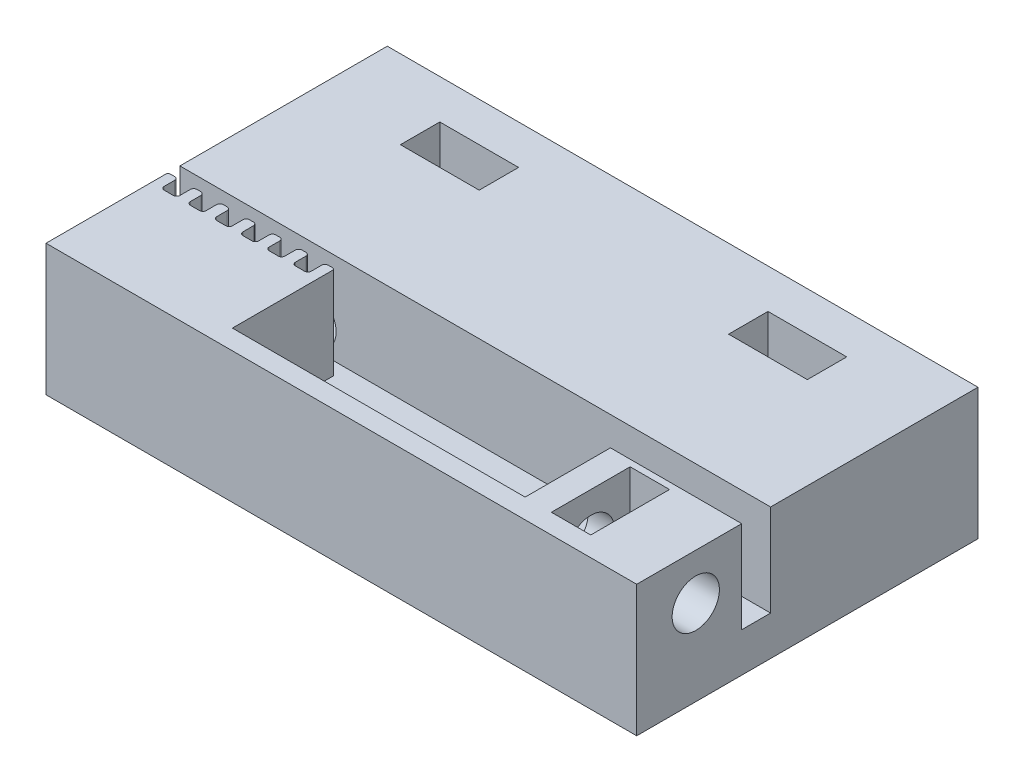
from build123d import *

# Parameters (mm, degrees)
SKETCH_1_W          = 45
SKETCH_1_H          = 26
EXTRUDE_1_DEPTH     = 10
CUT_EXTRUDE_1_DEPTH = 7
SKETCH_4_W          = 30
SKETCH_4_H          = 1.4
CUT_EXTRUDE_3_DEPTH = 7
SKETCH_5_R          = 1.8
CUT_EXTRUDE_4_DEPTH = 30
SKETCH_6_W          = 3
SKETCH_6_H          = 6
CUT_EXTRUDE_5_DEPTH = 6.5
SKETCH_7_W          = 22.3
SKETCH_7_H          = 8.113029467
CUT_EXTRUDE_7_DEPTH = 7
SKETCH_8_R          = 1.9
CUT_EXTRUDE_8_DEPTH = 15.9
SKETCH_10_W         = 6
SKETCH_10_H         = 3
CUT_EXTRUDE_9_DEPTH = 8.5


with BuildPart() as part:
    # 草图1 → 凸台-拉伸1 (new body)
    with BuildSketch(Plane(origin=(0, 0, 0), x_dir=(1, 0, 0), z_dir=(0, 1, 0))):
        with Locations((22.5, 13)):
            Rectangle(SKETCH_1_W, SKETCH_1_H)
    extrude(amount=EXTRUDE_1_DEPTH)

    # 草图3 → 切除-拉伸1 (cut)
    with BuildSketch(Plane(origin=(0, 10, 0), x_dir=(1, 0, 0), z_dir=(0, 1, 0))):
        with BuildLine():
            Line((43, 8), (43.7, 8))
            ThreePointArc((43.7, 8), (43.876776695, 8.073223305), (43.95, 8.25))
            Line((43.95, 8.25), (43.95, 9.05))
            ThreePointArc((43.95, 9.05), (44.023223305, 9.226776695), (44.2, 9.3))
            Line((44.2, 9.3), (44.5, 9.3))
            ThreePointArc((44.5, 9.3), (44.676776695, 9.226776695), (44.75, 9.05))
            Line((44.75, 9.05), (44.75, 8.25))
            ThreePointArc((44.75, 8.25), (44.823223305, 8.073223305), (45, 8))
            Line((45, 8), (45, 10.2))
            Line((45, 10.2), (0, 10.2))
            Line((0, 10.2), (0, 9.2))
            ThreePointArc((0, 9.2), (0.088196601, 9.273606798), (0.2, 9.3))
            Line((0.2, 9.3), (0.5, 9.3))
            ThreePointArc((0.5, 9.3), (0.676776695, 9.226776695), (0.75, 9.05))
            Line((0.75, 9.05), (0.75, 8.25))
            ThreePointArc((0.75, 8.25), (0.823223305, 8.073223305), (1, 8))
            Line((1, 8), (1.7, 8))
            ThreePointArc((1.7, 8), (1.876776695, 8.073223305), (1.95, 8.25))
            Line((1.95, 8.25), (1.95, 9.05))
            ThreePointArc((1.95, 9.05), (2.023223305, 9.226776695), (2.2, 9.3))
            Line((2.2, 9.3), (2.5, 9.3))
            ThreePointArc((2.5, 9.3), (2.676776695, 9.226776695), (2.75, 9.05))
            Line((2.75, 9.05), (2.75, 8.25))
            ThreePointArc((2.75, 8.25), (2.823223305, 8.073223305), (3, 8))
            Line((3, 8), (3.7, 8))
            ThreePointArc((3.7, 8), (3.876776695, 8.073223305), (3.95, 8.25))
            Line((3.95, 8.25), (3.95, 9.05))
            ThreePointArc((3.95, 9.05), (4.023223305, 9.226776695), (4.2, 9.3))
            Line((4.2, 9.3), (4.5, 9.3))
            ThreePointArc((4.5, 9.3), (4.676776695, 9.226776695), (4.75, 9.05))
            Line((4.75, 9.05), (4.75, 8.25))
            ThreePointArc((4.75, 8.25), (4.823223305, 8.073223305), (5, 8))
            Line((5, 8), (5.7, 8))
            ThreePointArc((5.7, 8), (5.876776695, 8.073223305), (5.95, 8.25))
            Line((5.95, 8.25), (5.95, 9.05))
            ThreePointArc((5.95, 9.05), (6.023223305, 9.226776695), (6.2, 9.3))
            Line((6.2, 9.3), (6.5, 9.3))
            ThreePointArc((6.5, 9.3), (6.676776695, 9.226776695), (6.75, 9.05))
            Line((6.75, 9.05), (6.75, 8.25))
            ThreePointArc((6.75, 8.25), (6.823223305, 8.073223305), (7, 8))
            Line((7, 8), (7.7, 8))
            ThreePointArc((7.7, 8), (7.876776695, 8.073223305), (7.95, 8.25))
            Line((7.95, 8.25), (7.95, 9.05))
            ThreePointArc((7.95, 9.05), (8.023223305, 9.226776695), (8.2, 9.3))
            Line((8.2, 9.3), (8.5, 9.3))
            ThreePointArc((8.5, 9.3), (8.676776695, 9.226776695), (8.75, 9.05))
            Line((8.75, 9.05), (8.75, 8.25))
            ThreePointArc((8.75, 8.25), (8.823223305, 8.073223305), (9, 8))
            Line((9, 8), (9.7, 8))
            ThreePointArc((9.7, 8), (9.876776695, 8.073223305), (9.95, 8.25))
            Line((9.95, 8.25), (9.95, 9.05))
            ThreePointArc((9.95, 9.05), (10.023223305, 9.226776695), (10.2, 9.3))
            Line((10.2, 9.3), (10.5, 9.3))
            ThreePointArc((10.5, 9.3), (10.676776695, 9.226776695), (10.75, 9.05))
            Line((10.75, 9.05), (10.75, 8.25))
            ThreePointArc((10.75, 8.25), (10.823223305, 8.073223305), (11, 8))
            Line((11, 8), (11.7, 8))
            ThreePointArc((11.7, 8), (11.876776695, 8.073223305), (11.95, 8.25))
            Line((11.95, 8.25), (11.95, 9.05))
            ThreePointArc((11.95, 9.05), (12.023223305, 9.226776695), (12.2, 9.3))
            Line((12.2, 9.3), (12.5, 9.3))
            ThreePointArc((12.5, 9.3), (12.676776695, 9.226776695), (12.75, 9.05))
            Line((12.75, 9.05), (12.75, 8.25))
            ThreePointArc((12.75, 8.25), (12.823223305, 8.073223305), (13, 8))
            Line((13, 8), (13.7, 8))
            ThreePointArc((13.7, 8), (13.876776695, 8.073223305), (13.95, 8.25))
            Line((13.95, 8.25), (13.95, 9.05))
            ThreePointArc((13.95, 9.05), (14.023223305, 9.226776695), (14.2, 9.3))
            Line((14.2, 9.3), (14.5, 9.3))
            ThreePointArc((14.5, 9.3), (14.676776695, 9.226776695), (14.75, 9.05))
            Line((14.75, 9.05), (14.75, 8.25))
            ThreePointArc((14.75, 8.25), (14.823223305, 8.073223305), (15, 8))
            Line((15, 8), (15.7, 8))
            ThreePointArc((15.7, 8), (15.876776695, 8.073223305), (15.95, 8.25))
            Line((15.95, 8.25), (15.95, 9.05))
            ThreePointArc((15.95, 9.05), (16.023223305, 9.226776695), (16.2, 9.3))
            Line((16.2, 9.3), (16.5, 9.3))
            ThreePointArc((16.5, 9.3), (16.676776695, 9.226776695), (16.75, 9.05))
            Line((16.75, 9.05), (16.75, 8.25))
            ThreePointArc((16.75, 8.25), (16.823223305, 8.073223305), (17, 8))
            Line((17, 8), (17.7, 8))
            ThreePointArc((17.7, 8), (17.876776695, 8.073223305), (17.95, 8.25))
            Line((17.95, 8.25), (17.95, 9.05))
            ThreePointArc((17.95, 9.05), (18.023223305, 9.226776695), (18.2, 9.3))
            Line((18.2, 9.3), (18.5, 9.3))
            ThreePointArc((18.5, 9.3), (18.676776695, 9.226776695), (18.75, 9.05))
            Line((18.75, 9.05), (18.75, 8.25))
            ThreePointArc((18.75, 8.25), (18.823223305, 8.073223305), (19, 8))
            Line((19, 8), (19.7, 8))
            ThreePointArc((19.7, 8), (19.876776695, 8.073223305), (19.95, 8.25))
            Line((19.95, 8.25), (19.95, 9.05))
            ThreePointArc((19.95, 9.05), (20.023223305, 9.226776695), (20.2, 9.3))
            Line((20.2, 9.3), (20.5, 9.3))
            ThreePointArc((20.5, 9.3), (20.676776695, 9.226776695), (20.75, 9.05))
            Line((20.75, 9.05), (20.75, 8.25))
            ThreePointArc((20.75, 8.25), (20.823223305, 8.073223305), (21, 8))
            Line((21, 8), (21.7, 8))
            ThreePointArc((21.7, 8), (21.876776695, 8.073223305), (21.95, 8.25))
            Line((21.95, 8.25), (21.95, 9.05))
            ThreePointArc((21.95, 9.05), (22.023223305, 9.226776695), (22.2, 9.3))
            Line((22.2, 9.3), (22.5, 9.3))
            ThreePointArc((22.5, 9.3), (22.676776695, 9.226776695), (22.75, 9.05))
            Line((22.75, 9.05), (22.75, 8.25))
            ThreePointArc((22.75, 8.25), (22.823223305, 8.073223305), (23, 8))
            Line((23, 8), (23.7, 8))
            ThreePointArc((23.7, 8), (23.876776695, 8.073223305), (23.95, 8.25))
            Line((23.95, 8.25), (23.95, 9.05))
            ThreePointArc((23.95, 9.05), (24.023223305, 9.226776695), (24.2, 9.3))
            Line((24.2, 9.3), (24.5, 9.3))
            ThreePointArc((24.5, 9.3), (24.676776695, 9.226776695), (24.75, 9.05))
            Line((24.75, 9.05), (24.75, 8.25))
            ThreePointArc((24.75, 8.25), (24.823223305, 8.073223305), (25, 8))
            Line((25, 8), (25.7, 8))
            ThreePointArc((25.7, 8), (25.876776695, 8.073223305), (25.95, 8.25))
            Line((25.95, 8.25), (25.95, 9.05))
            ThreePointArc((25.95, 9.05), (26.023223305, 9.226776695), (26.2, 9.3))
            Line((26.2, 9.3), (26.5, 9.3))
            ThreePointArc((26.5, 9.3), (26.676776695, 9.226776695), (26.75, 9.05))
            Line((26.75, 9.05), (26.75, 8.25))
            ThreePointArc((26.75, 8.25), (26.823223305, 8.073223305), (27, 8))
            Line((27, 8), (27.7, 8))
            ThreePointArc((27.7, 8), (27.876776695, 8.073223305), (27.95, 8.25))
            Line((27.95, 8.25), (27.95, 9.05))
            ThreePointArc((27.95, 9.05), (28.023223305, 9.226776695), (28.2, 9.3))
            Line((28.2, 9.3), (28.5, 9.3))
            ThreePointArc((28.5, 9.3), (28.676776695, 9.226776695), (28.75, 9.05))
            Line((28.75, 9.05), (28.75, 8.25))
            ThreePointArc((28.75, 8.25), (28.823223305, 8.073223305), (29, 8))
            Line((29, 8), (29.7, 8))
            ThreePointArc((29.7, 8), (29.876776695, 8.073223305), (29.95, 8.25))
            Line((29.95, 8.25), (29.95, 9.05))
            ThreePointArc((29.95, 9.05), (30.023223305, 9.226776695), (30.2, 9.3))
            Line((30.2, 9.3), (30.5, 9.3))
            ThreePointArc((30.5, 9.3), (30.676776695, 9.226776695), (30.75, 9.05))
            Line((30.75, 9.05), (30.75, 8.25))
            ThreePointArc((30.75, 8.25), (30.823223305, 8.073223305), (31, 8))
            Line((31, 8), (31.7, 8))
            ThreePointArc((31.7, 8), (31.876776695, 8.073223305), (31.95, 8.25))
            Line((31.95, 8.25), (31.95, 9.05))
            ThreePointArc((31.95, 9.05), (32.023223305, 9.226776695), (32.2, 9.3))
            Line((32.2, 9.3), (32.5, 9.3))
            ThreePointArc((32.5, 9.3), (32.676776695, 9.226776695), (32.75, 9.05))
            Line((32.75, 9.05), (32.75, 8.25))
            ThreePointArc((32.75, 8.25), (32.823223305, 8.073223305), (33, 8))
            Line((33, 8), (33.7, 8))
            ThreePointArc((33.7, 8), (33.876776695, 8.073223305), (33.95, 8.25))
            Line((33.95, 8.25), (33.95, 9.05))
            ThreePointArc((33.95, 9.05), (34.023223305, 9.226776695), (34.2, 9.3))
            Line((34.2, 9.3), (34.5, 9.3))
            ThreePointArc((34.5, 9.3), (34.676776695, 9.226776695), (34.75, 9.05))
            Line((34.75, 9.05), (34.75, 8.25))
            ThreePointArc((34.75, 8.25), (34.823223305, 8.073223305), (35, 8))
            Line((35, 8), (35.7, 8))
            ThreePointArc((35.7, 8), (35.876776695, 8.073223305), (35.95, 8.25))
            Line((35.95, 8.25), (35.95, 9.05))
            ThreePointArc((35.95, 9.05), (36.023223305, 9.226776695), (36.2, 9.3))
            Line((36.2, 9.3), (36.5, 9.3))
            ThreePointArc((36.5, 9.3), (36.676776695, 9.226776695), (36.75, 9.05))
            Line((36.75, 9.05), (36.75, 8.25))
            ThreePointArc((36.75, 8.25), (36.823223305, 8.073223305), (37, 8))
            Line((37, 8), (37.7, 8))
            ThreePointArc((37.7, 8), (37.876776695, 8.073223305), (37.95, 8.25))
            Line((37.95, 8.25), (37.95, 9.05))
            ThreePointArc((37.95, 9.05), (38.023223305, 9.226776695), (38.2, 9.3))
            Line((38.2, 9.3), (38.5, 9.3))
            ThreePointArc((38.5, 9.3), (38.676776695, 9.226776695), (38.75, 9.05))
            Line((38.75, 9.05), (38.75, 8.25))
            ThreePointArc((38.75, 8.25), (38.823223305, 8.073223305), (39, 8))
            Line((39, 8), (39.7, 8))
            ThreePointArc((39.7, 8), (39.876776695, 8.073223305), (39.95, 8.25))
            Line((39.95, 8.25), (39.95, 9.05))
            ThreePointArc((39.95, 9.05), (40.023223305, 9.226776695), (40.2, 9.3))
            Line((40.2, 9.3), (40.5, 9.3))
            ThreePointArc((40.5, 9.3), (40.676776695, 9.226776695), (40.75, 9.05))
            Line((40.75, 9.05), (40.75, 8.25))
            ThreePointArc((40.75, 8.25), (40.823223305, 8.073223305), (41, 8))
            Line((41, 8), (41.7, 8))
            ThreePointArc((41.7, 8), (41.876776695, 8.073223305), (41.95, 8.25))
            Line((41.95, 8.25), (41.95, 9.05))
            ThreePointArc((41.95, 9.05), (42.023223305, 9.226776695), (42.2, 9.3))
            Line((42.2, 9.3), (42.5, 9.3))
            ThreePointArc((42.5, 9.3), (42.676776695, 9.226776695), (42.75, 9.05))
            Line((42.75, 9.05), (42.75, 8.25))
            ThreePointArc((42.75, 8.25), (42.823223305, 8.073223305), (43, 8))
        make_face()
    extrude(amount=-CUT_EXTRUDE_1_DEPTH, mode=Mode.SUBTRACT)

    # 草图4 → 切除-拉伸3 (cut)
    with BuildSketch(Plane(origin=(0, 10, 0), x_dir=(1, 0, 0), z_dir=(0, 1, 0))):
        with Locations((30, 8.7)):
            Rectangle(SKETCH_4_W, SKETCH_4_H)
    extrude(amount=-CUT_EXTRUDE_3_DEPTH, mode=Mode.SUBTRACT)

    # 草图5 → 切除-拉伸4 (cut)
    with BuildSketch(Plane(origin=(45, 0, 0), x_dir=(0, 0, -1), z_dir=(1, 0, 0))):
        with Locations((4.5, 6.5)):
            Circle(SKETCH_5_R)
    extrude(amount=-CUT_EXTRUDE_4_DEPTH, mode=Mode.SUBTRACT)

    # 草图6 → 切除-拉伸5 (cut)
    with BuildSketch(Plane(origin=(0, 10, 0), x_dir=(1, 0, 0), z_dir=(0, 1, 0))):
        with Locations((38.5, 4.5)):
            Rectangle(SKETCH_6_W, SKETCH_6_H)
    extrude(amount=-CUT_EXTRUDE_5_DEPTH, mode=Mode.SUBTRACT)

    # 草图7 → 切除-拉伸7 (cut)
    with BuildSketch(Plane(origin=(0, 10, 0), x_dir=(1, 0, 0), z_dir=(0, 1, 0))):
        with Locations((23.85, 5.556514734)):
            Rectangle(SKETCH_7_W, SKETCH_7_H)
    extrude(amount=-CUT_EXTRUDE_7_DEPTH, mode=Mode.SUBTRACT)

    # 草图8 → 切除-拉伸8 (cut)
    with BuildSketch(Plane(origin=(0, 0, -26), x_dir=(-1, 0, 0), z_dir=(0, 0, -1))):
        with Locations((-10, 5)):
            Circle(SKETCH_8_R)
        with Locations((-35, 5)):
            Circle(SKETCH_8_R)
    extrude(amount=-CUT_EXTRUDE_8_DEPTH, mode=Mode.SUBTRACT)

    # 草图10 → 切除-拉伸9 (cut)
    with BuildSketch(Plane(origin=(0, 10, 0), x_dir=(1, 0, 0), z_dir=(0, 1, 0))):
        with Locations((10, 21.5)):
            Rectangle(SKETCH_10_W, SKETCH_10_H)
        with Locations((35, 21.5)):
            Rectangle(SKETCH_10_W, SKETCH_10_H)
    extrude(amount=-CUT_EXTRUDE_9_DEPTH, mode=Mode.SUBTRACT)


solid = part.part
